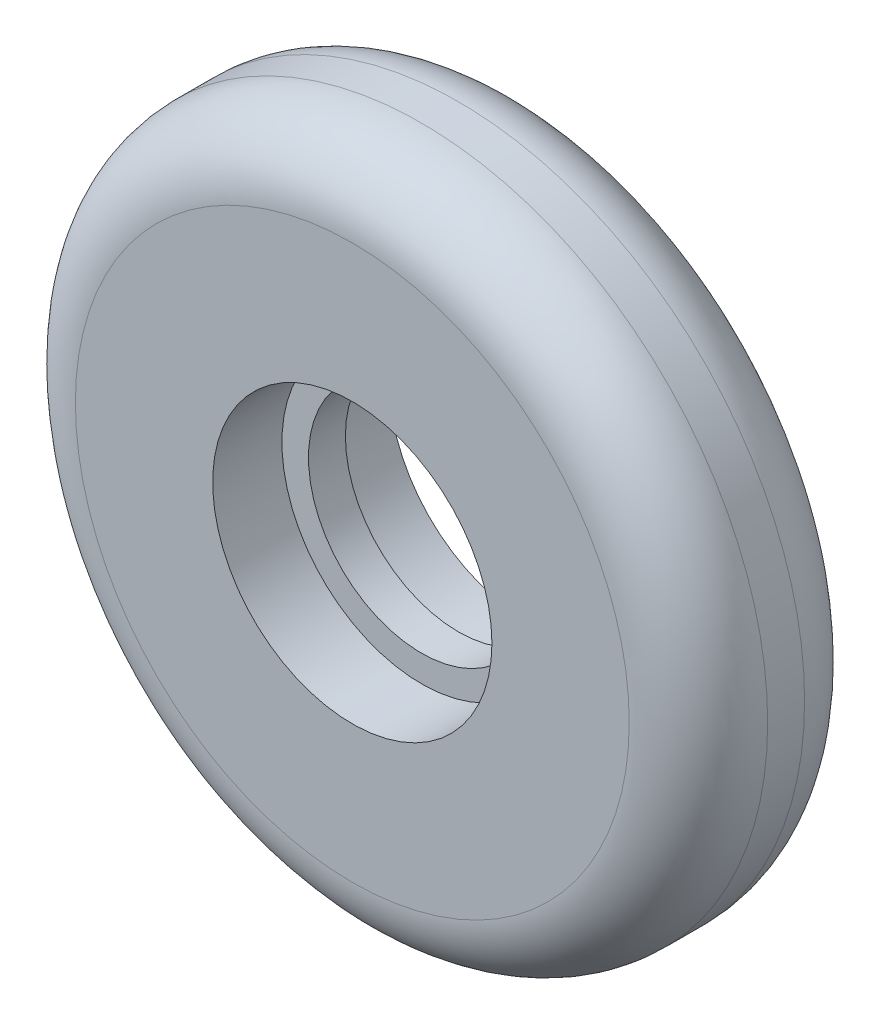
from build123d import *

# Parameters (mm, degrees)
SKETCH_1_R          = 15
EXTRUDE_1_DEPTH     = 7.6
SKETCH_2_R          = 6.05
CUT_EXTRUDE_1_DEPTH = 3
SKETCH_3_R          = 6
CUT_EXTRUDE_2_DEPTH = 3
SKETCH_4_R          = 4.9
CUT_EXTRUDE_3_DEPTH = 22.706220307
FILLET_1_R          = 3


with BuildPart() as part:
    # 草图1 → 凸台-拉伸1 (new body)
    with BuildSketch(Plane.XY):
        with Locations(Location((0, 0, 0), (0, 0, 180))):
            Circle(SKETCH_1_R)
    extrude(amount=EXTRUDE_1_DEPTH)

    # 草图2 → 切除-拉伸1 (cut)
    with BuildSketch(Plane.XY.offset(7.6)):
        Circle(SKETCH_2_R)
    extrude(amount=-CUT_EXTRUDE_1_DEPTH, mode=Mode.SUBTRACT)

    # 草图3 → 切除-拉伸2 (cut)
    with BuildSketch(Plane(origin=(0, 0, 0), x_dir=(-1, 0, 0), z_dir=(0, 0, -1))):
        Circle(SKETCH_3_R)
    extrude(amount=-CUT_EXTRUDE_2_DEPTH, mode=Mode.SUBTRACT)

    # 草图4 → 切除-拉伸3 (cut, through all)
    with BuildSketch(Plane.XY.offset(4.6)):
        Circle(SKETCH_4_R)
    extrude(amount=-CUT_EXTRUDE_3_DEPTH, mode=Mode.SUBTRACT)

    # 圆角1
    fillet_1_edges = [part.edges().sort_by_distance(p)[0] for p in [
        (15, 0, 0),
        (15, 0, 7.6),
    ]]
    fillet(fillet_1_edges, radius=FILLET_1_R)


solid = part.part
